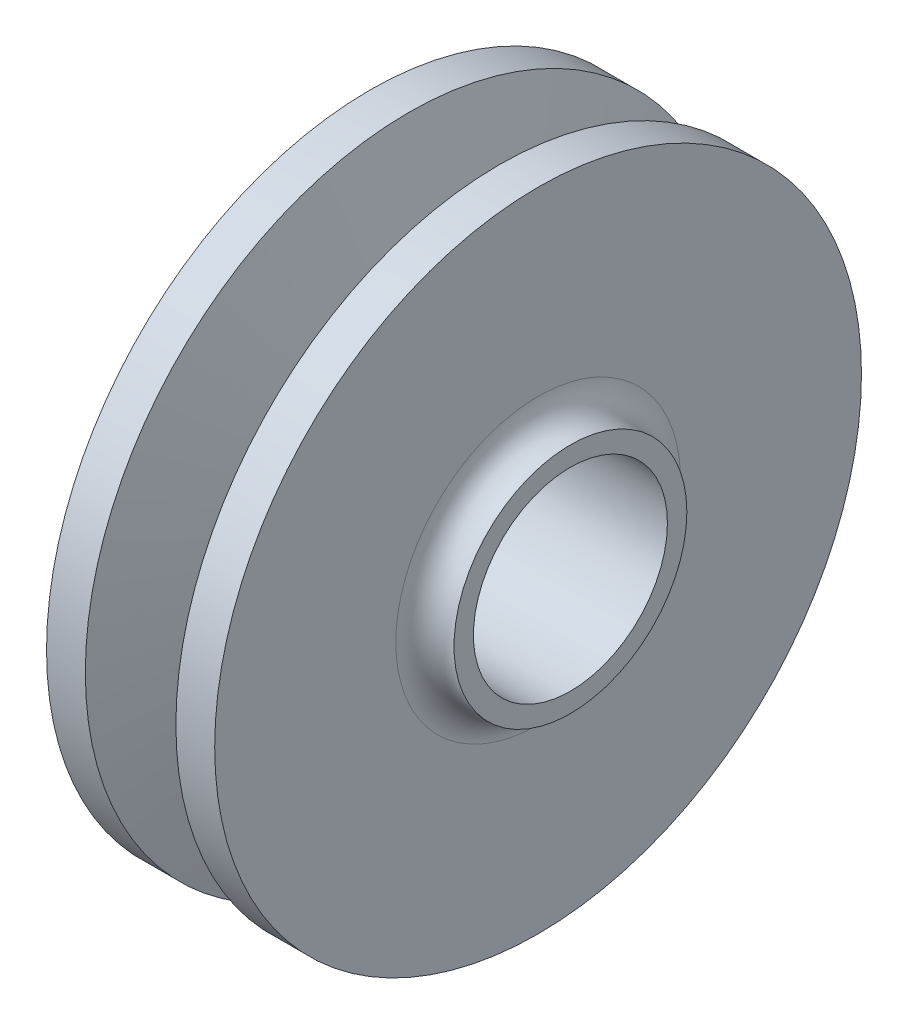
from build123d import *


with BuildPart() as part:
    # Sketch1 → Revolve1 (revolve)
    with BuildSketch(Plane.XY, mode=Mode.PRIVATE) as revolve1_sk:
        with BuildLine():
            Line((18, 15), (-18, 15))
            Line((-18, 15), (-18, 18))
            ThreePointArc((-18, 18), (-14.538750305, 18.798437881), (-13, 22))
            Line((-13, 22), (-13, 50))
            Line((-13, 50), (-7, 50))
            Line((-7, 50), (-3, 35))
            Line((-3, 35), (3, 35))
            Line((3, 35), (7, 50))
            Line((7, 50), (13, 50))
            Line((13, 50), (13, 22))
            ThreePointArc((13, 22), (14.538750305, 18.798437881), (18, 18))
            Line((18, 18), (18, 15))
        make_face()
    revolve(revolve1_sk.sketch.rotate(Axis((38.229944377, 0, 0), (-1, 0, 0)), 90), axis=Axis((38.229944377, 0, 0), (-1, 0, 0)))


solid = part.part
